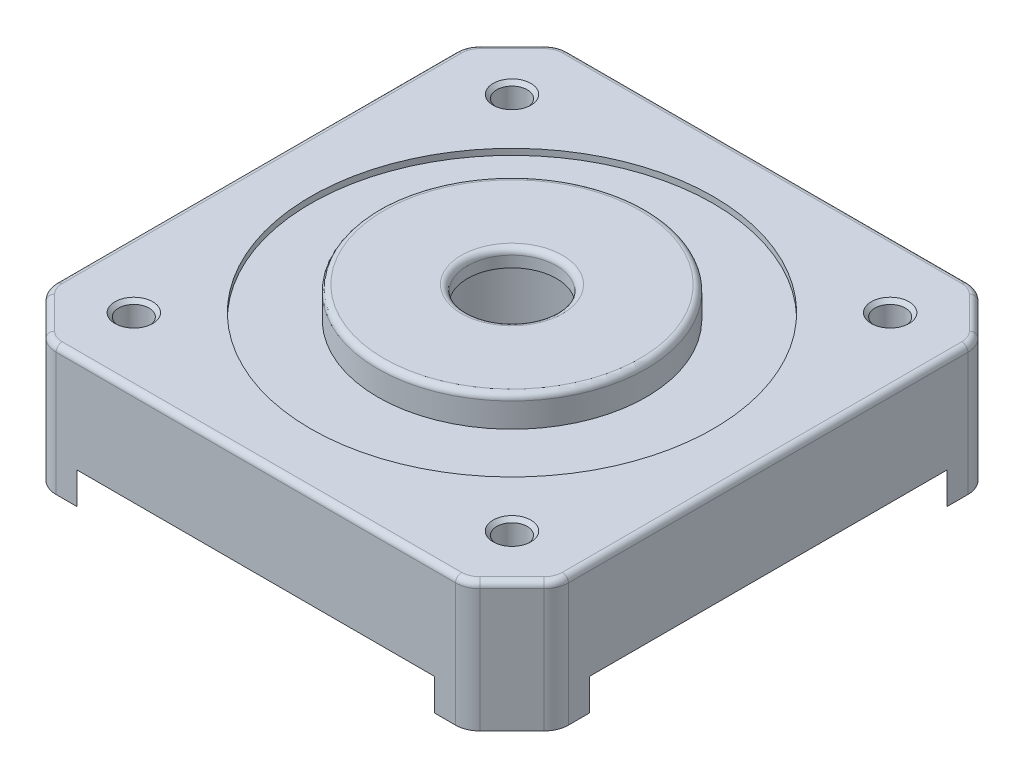
from build123d import *

# Parameters (mm, degrees)
SKETCH_1_R          = 16.5
SKETCH_1_R_2        = 1.25
EXTRUDE_1_DEPTH     = 8
SKETCH_1_3_R        = 16.5
SKETCH_1_3_R_2      = 11
EXTRUDE_2_DEPTH     = 7.5
SKETCH_1_4_R        = 11
SKETCH_1_4_R_2      = 3.65
EXTRUDE_3_DEPTH     = 10
EXTRUDE_4_DEPTH     = 2.6
SKETCH_2_R          = 8
CUT_EXTRUDE_1_DEPTH = 8.6
FILLET_1_R          = 2
FILLET_2_R          = 0.5
CHAMFER_1_SIZE      = 0.3


with BuildPart() as part:
    # Эскиз1 → Бобышка-Вытянуть1 (new body)
    with BuildSketch(Plane(origin=(0, 0, 0), x_dir=(1, 0, 0), z_dir=(0, 1, 0))):
        Polygon((-17.2, 21), (-21, 17.2), (-21, -17.2), (-17.2, -21), (17.2, -21), (21, -17.2), (21, 17.2), (17.2, 21), align=None)
        Circle(SKETCH_1_R, mode=Mode.SUBTRACT)
        with Locations((15.5, 15.5)):
            Circle(SKETCH_1_R_2, mode=Mode.SUBTRACT)
        with Locations((-15.5, -15.5)):
            Circle(SKETCH_1_R_2, mode=Mode.SUBTRACT)
        with Locations((15.5, -15.5)):
            Circle(SKETCH_1_R_2, mode=Mode.SUBTRACT)
        with Locations((-15.5, 15.5)):
            Circle(SKETCH_1_R_2, mode=Mode.SUBTRACT)
    extrude(amount=EXTRUDE_1_DEPTH)

    # Эскиз1<3> → Бобышка-Вытянуть2 (add)
    with BuildSketch(Plane(origin=(0, 0, 0), x_dir=(1, 0, 0), z_dir=(0, 1, 0))):
        Circle(SKETCH_1_3_R)
        Circle(SKETCH_1_3_R_2, mode=Mode.SUBTRACT)
    extrude(amount=EXTRUDE_2_DEPTH)

    # Эскиз1<4> → Бобышка-Вытянуть3 (add)
    with BuildSketch(Plane(origin=(0, 0, 0), x_dir=(1, 0, 0), z_dir=(0, 1, 0))):
        Circle(SKETCH_1_4_R)
        Circle(SKETCH_1_4_R_2, mode=Mode.SUBTRACT)
    extrude(amount=EXTRUDE_3_DEPTH)

    # Эскиз1<5> → Бобышка-Вытянуть4 (add)
    with BuildSketch(Plane(origin=(0, 0, 0), x_dir=(1, 0, 0), z_dir=(0, 1, 0))):
        with BuildLine():
            Line((-17.2, 21), (-21, 17.2))
            Line((-21, 17.2), (-21, 14.641038215))
            ThreePointArc((-21, 14.641038215), (-18.101933598, 18.101933598), (-14.641038215, 21))
            Line((-14.641038215, 21), (-17.2, 21))
        make_face()
        with BuildLine():
            ThreePointArc((-14.641038215, -21), (-18.101933598, -18.101933598), (-21, -14.641038215))
            Line((-21, -14.641038215), (-21, -17.2))
            Line((-21, -17.2), (-17.2, -21))
            Line((-17.2, -21), (-14.641038215, -21))
        make_face()
        with BuildLine():
            Line((17.2, 21), (14.641038215, 21))
            ThreePointArc((14.641038215, 21), (18.101933598, 18.101933598), (21, 14.641038215))
            Line((21, 14.641038215), (21, 17.2))
            Line((21, 17.2), (17.2, 21))
        make_face()
        with BuildLine():
            ThreePointArc((21, -14.641038215), (18.101933598, -18.101933598), (14.641038215, -21))
            Line((14.641038215, -21), (17.2, -21))
            Line((17.2, -21), (21, -17.2))
            Line((21, -17.2), (21, -14.641038215))
        make_face()
    extrude(amount=-EXTRUDE_4_DEPTH)

    # Эскиз2 → Вырез-Вытянуть1 (cut)
    with BuildSketch(Plane.XZ):
        Circle(SKETCH_2_R)
    extrude(amount=-CUT_EXTRUDE_1_DEPTH, mode=Mode.SUBTRACT)

    # Скругление1
    fillet_1_edges = [part.edges().sort_by_distance(p)[0] for p in [
        (21, 2.7, 17.2),
        (17.2, 2.7, 21),
        (-17.2, 2.7, 21),
        (-21, 2.7, 17.2),
        (-21, 2.7, -17.2),
        (-17.2, 2.7, -21),
        (17.2, 2.7, -21),
        (21, 2.7, -17.2),
    ]]
    fillet(fillet_1_edges, radius=FILLET_1_R)

    # Скругление2
    fillet_2_edges = [part.edges().sort_by_distance(p)[0] for p in [
        (-17.13693974, 8, 20.847759065),
        (-19.1, 8, 19.1),
        (-20.847759065, 8, 17.13693974),
        (-21, 8, 0),
        (-20.847759065, 8, -17.13693974),
        (-19.1, 8, -19.1),
        (-17.13693974, 8, -20.847759065),
        (0, 8, -21),
        (17.13693974, 8, -20.847759065),
        (19.1, 8, -19.1),
        (20.847759065, 8, -17.13693974),
        (21, 8, 0),
        (20.847759065, 8, 17.13693974),
        (19.1, 8, 19.1),
        (17.13693974, 8, 20.847759065),
        (0, 8, 21),
        (-3.65, 10, 0),
        (-11, 10, 0),
    ]]
    fillet(fillet_2_edges, radius=FILLET_2_R)

    # Фаска1
    chamfer_1_edges = [part.edges().sort_by_distance(p)[0] for p in [
        (-16.75, 8, 15.5),
        (-16.75, 8, -15.5),
        (14.25, 8, -15.5),
        (14.25, 8, 15.5),
    ]]
    chamfer(chamfer_1_edges, length=CHAMFER_1_SIZE)


solid = part.part
